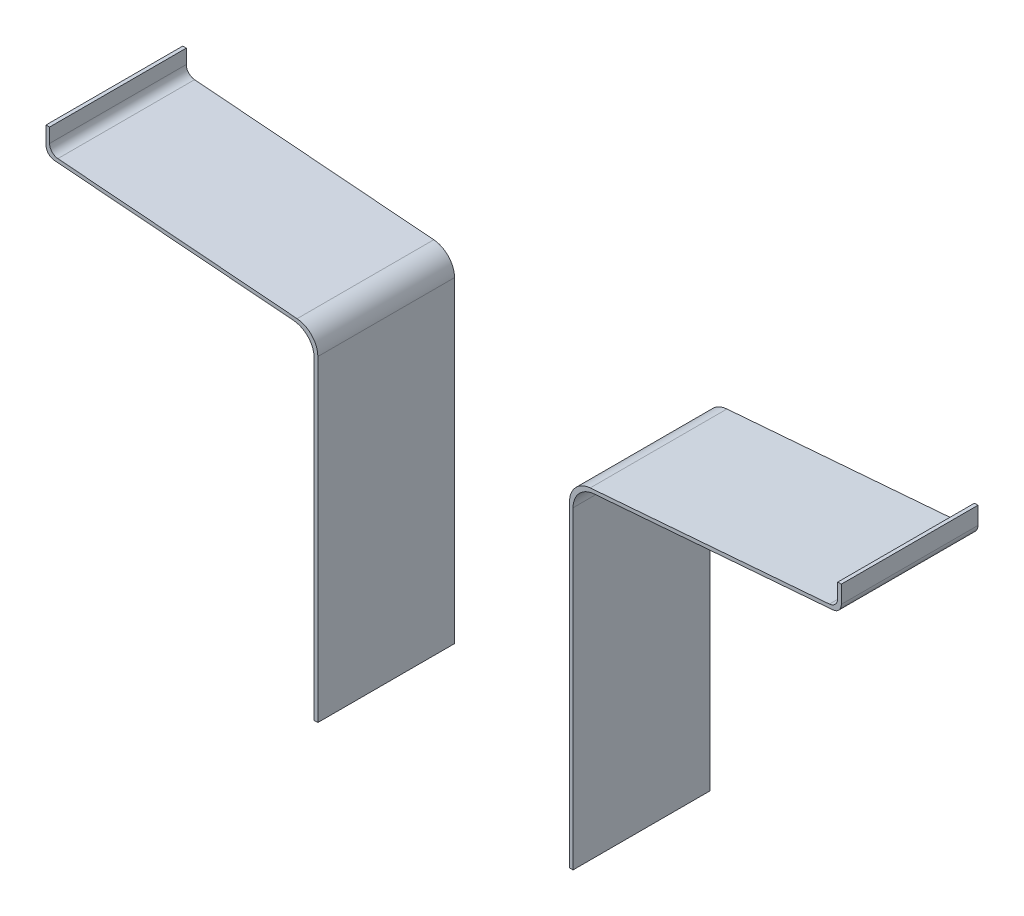
from build123d import *

# Parameters (mm, degrees)
BOSS_EXTRUDE1_DEPTH   = 60.7
BOSS_EXTRUDE1_2_DEPTH = 60.7
FILLET1_R             = 10
FILLET2_R             = 10
FILLET3_R             = 4
FILLET4_R             = 4


with BuildPart() as part:
    # Sketch1 → Boss-Extrude1 (new body)
    with BuildSketch(Plane.XY):
        Polygon((350, -10), (230.88, -19.468825337), (230.88, -169.468825337), (232.47, -169.468825337), (232.47, -20.93745195), (351.5875, -11.468825337), (351.5875, 0), (350, 0), align=None)
    extrude(amount=BOSS_EXTRUDE1_DEPTH)

    # Fillet1
    fillet1_edges = [part.edges().sort_by_distance(p)[0] for p in [
        (232.47, -20.93745195, 30.35),
        (230.88, -19.468825337, 30.35),
    ]]
    fillet(fillet1_edges, radius=FILLET1_R)

    # Fillet3
    fillet3_edges = [part.edges().sort_by_distance(p)[0] for p in [
        (351.5875, -11.468825337, 30.35),
        (350, -10, 30.35),
    ]]
    fillet(fillet3_edges, radius=FILLET3_R)


with BuildPart() as body_2:
    # Sketch1 → Boss-Extrude1 2 (new body)
    with BuildSketch(Plane.XY):
        Polygon((0, 0), (-1.5875, 0), (-1.5875, -11.468825337), (117.53, -20.93745195), (117.53, -169.468825337), (119.12, -169.468825337), (119.12, -19.468825337), (0, -10), align=None)
    extrude(amount=BOSS_EXTRUDE1_2_DEPTH)

    # Fillet2
    fillet2_edges = [body_2.edges().sort_by_distance(p)[0] for p in [
        (119.12, -19.468825337, 30.35),
        (117.53, -20.93745195, 30.35),
    ]]
    fillet(fillet2_edges, radius=FILLET2_R)

    # Fillet4
    fillet4_edges = [body_2.edges().sort_by_distance(p)[0] for p in [
        (0, -10, 30.35),
        (-1.5875, -11.468825337, 30.35),
    ]]
    fillet(fillet4_edges, radius=FILLET4_R)


solid = Compound([part.part, body_2.part])
